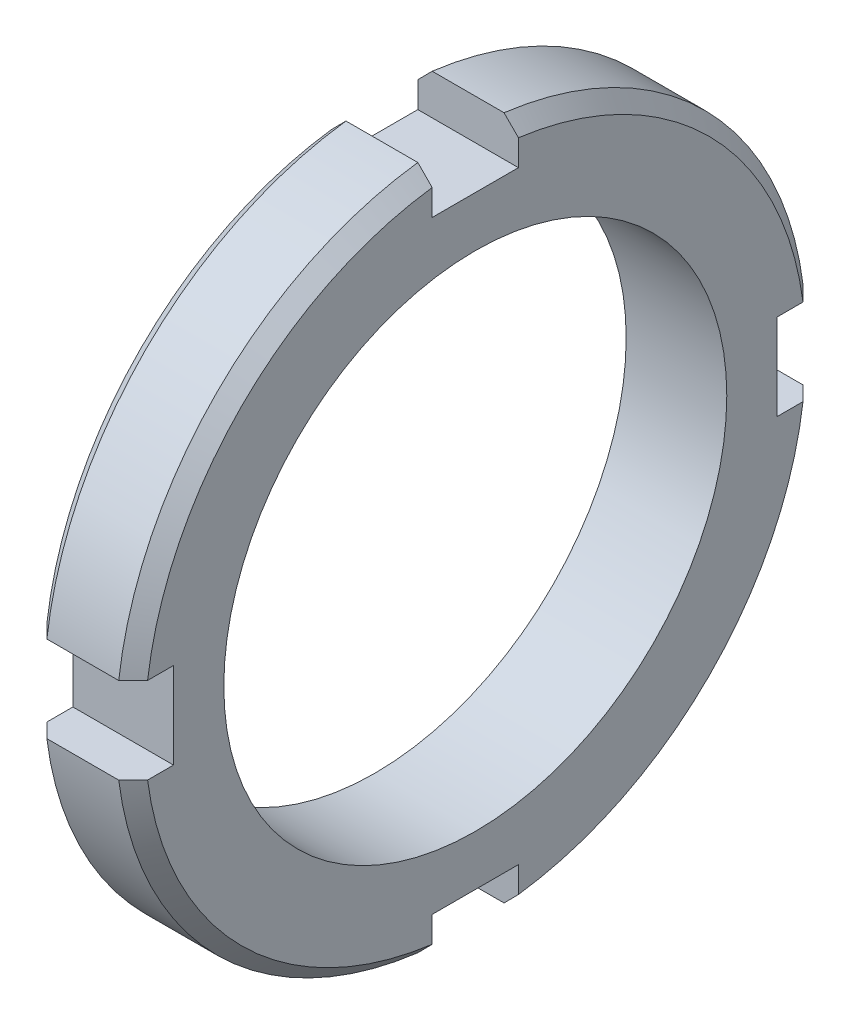
from build123d import *

# Parameters (mm, degrees)
SKETCH_2_W       = 5
SKETCH_2_H       = 6
SKETCH_2_W_2     = 6
SKETCH_2_H_2     = 5
F_02_SLOTS_DEPTH = 8


with BuildPart() as part:
    # 草图1 → 01_RING (revolve)
    with BuildSketch(Plane.XY, mode=Mode.PRIVATE) as f_01_ring_sk:
        Polygon((0, 17.5), (0, 23), (1, 24), (6, 24), (7, 23), (7, 17.5), align=None)
    revolve(f_01_ring_sk.sketch.rotate(Axis((-5, 0, 0), (1, 0, 0)), 90), axis=Axis((-5, 0, 0), (1, 0, 0)))

    # 草图2 → 02_SLOTS (cut)
    with BuildSketch(Plane(origin=(-0.5, 0, 0), x_dir=(0, 0, -1), z_dir=(1, 0, 0))):
        with Locations((23.5, 0)):
            Rectangle(SKETCH_2_W, SKETCH_2_H)
        with Locations((-23.5, 0)):
            Rectangle(SKETCH_2_W, SKETCH_2_H)
        with Locations((0, 23.5)):
            Rectangle(SKETCH_2_W_2, SKETCH_2_H_2)
        with Locations((0, -23.5)):
            Rectangle(SKETCH_2_W_2, SKETCH_2_H_2)
    extrude(amount=F_02_SLOTS_DEPTH, mode=Mode.SUBTRACT)


solid = part.part
